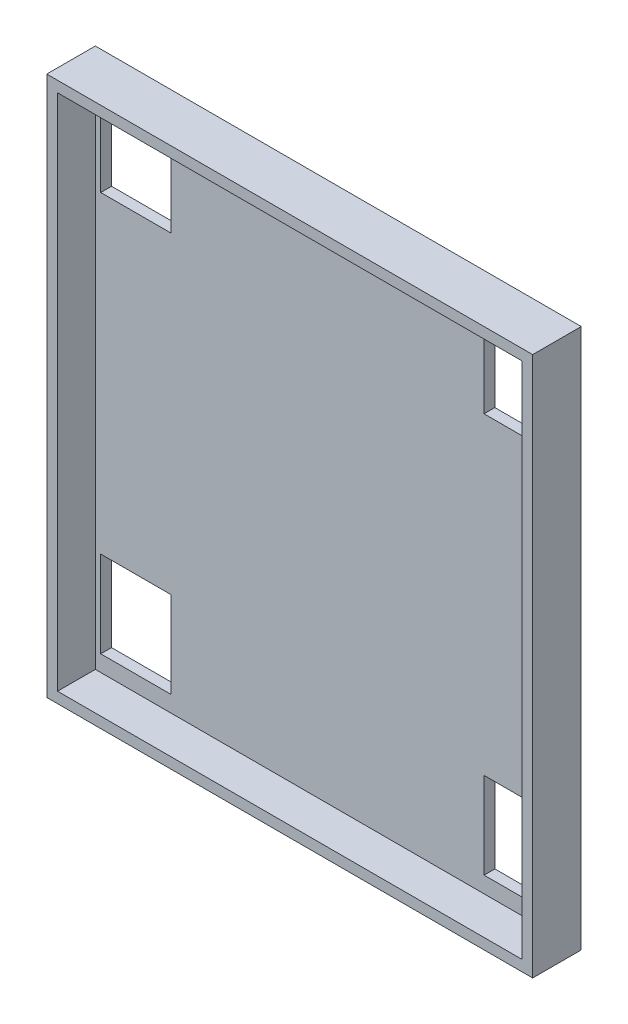
from build123d import *

# Parameters (mm, degrees)
ESBO_O1_W                = 90
ESBO_O1_H                = 100
ESBO_O1_W_2              = 13
ESBO_O1_H_2              = 16
RESSALTO_EXTRUS_O1_DEPTH = 2
ESBO_O2_W                = 90
ESBO_O2_H                = 100
ESBO_O2_W_2              = 86
ESBO_O2_H_2              = 96
RESSALTO_EXTRUS_O2_DEPTH = 7


with BuildPart() as part:
    # Esboço1 → Ressalto-extrusão1 (new body)
    with BuildSketch(Plane.XY):
        Rectangle(ESBO_O1_W, ESBO_O1_H)
        with Locations((35.5, 37)):
            Rectangle(ESBO_O1_W_2, ESBO_O1_H_2, mode=Mode.SUBTRACT)
        with Locations((35.5, -37)):
            Rectangle(ESBO_O1_W_2, ESBO_O1_H_2, mode=Mode.SUBTRACT)
        with Locations((-35.5, -37)):
            Rectangle(ESBO_O1_W_2, ESBO_O1_H_2, mode=Mode.SUBTRACT)
        with Locations((-35.5, 37)):
            Rectangle(ESBO_O1_W_2, ESBO_O1_H_2, mode=Mode.SUBTRACT)
    extrude(amount=RESSALTO_EXTRUS_O1_DEPTH)

    # Esboço2 → Ressalto-extrusão2 (add)
    with BuildSketch(Plane.XY.offset(2)):
        Rectangle(ESBO_O2_W, ESBO_O2_H)
        Rectangle(ESBO_O2_W_2, ESBO_O2_H_2, mode=Mode.SUBTRACT)
    extrude(amount=RESSALTO_EXTRUS_O2_DEPTH)


solid = part.part
